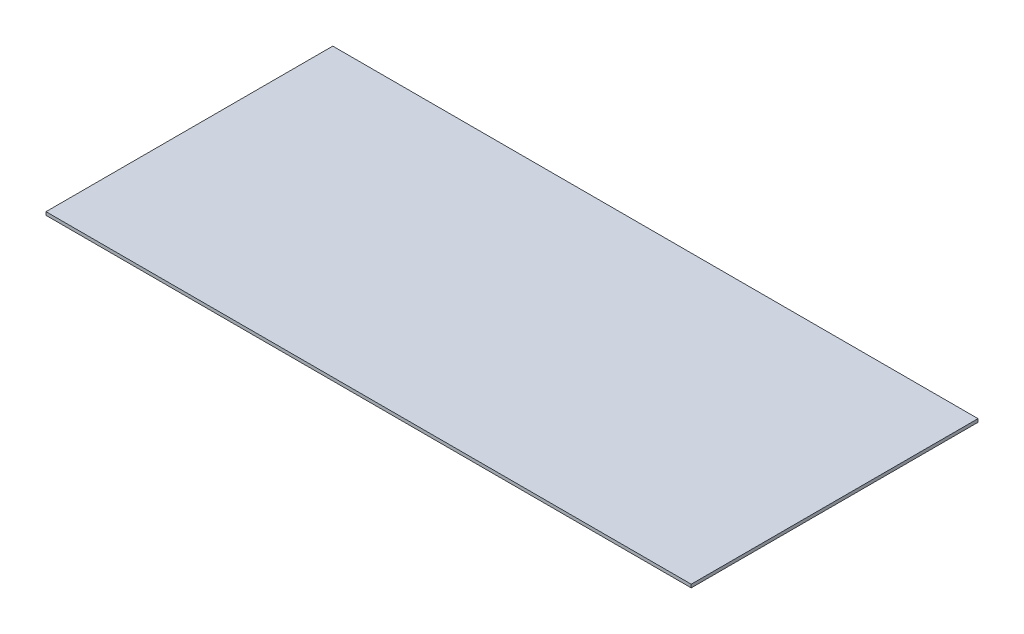
from build123d import *

# Parameters (mm, degrees)
TEXT_BORDER_W = 180
TEXT_BORDER_H = 80
BODY_DEPTH    = 0.9


with BuildPart() as part:
    # Text / Border → Body (new body)
    with BuildSketch(Plane(origin=(0, 0, 0), x_dir=(1, 0, 0), z_dir=(0, 1, 0))):
        with Locations((90, 40)):
            Rectangle(TEXT_BORDER_W, TEXT_BORDER_H)
    extrude(amount=BODY_DEPTH)


solid = part.part
